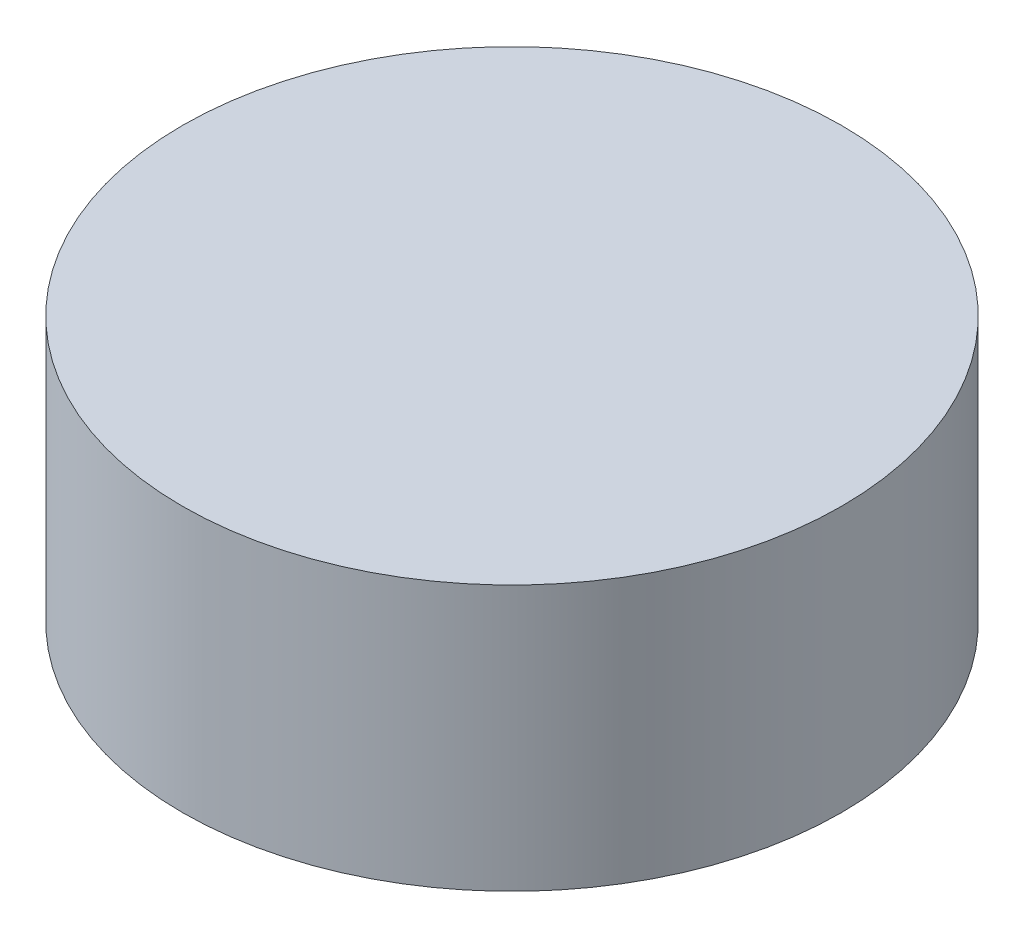
from build123d import *

# Parameters (mm, degrees)
SKETCH1_R           = 43.5
SKETCH1_R_2         = 42
BOSS_EXTRUDE1_DEPTH = 32
SKETCH2_R           = 43.5
BOSS_EXTRUDE2_DEPTH = 3


with BuildPart() as part:
    # Sketch1 → Boss-Extrude1 (new body)
    with BuildSketch(Plane(origin=(0, 0, 0), x_dir=(1, 0, 0), z_dir=(0, 1, 0))):
        with Locations(Location((0, 0, 0), (0, 0, 270))):
            Circle(SKETCH1_R)
        with Locations(Location((0, 0, 0), (0, 0, 270))):
            Circle(SKETCH1_R_2, mode=Mode.SUBTRACT)
    extrude(amount=BOSS_EXTRUDE1_DEPTH)

    # Sketch2 → Boss-Extrude2 (add)
    with BuildSketch(Plane(origin=(0, 32, 0), x_dir=(1, 0, 0), z_dir=(0, 1, 0))):
        with Locations(Location((0, 0, 0), (0, 0, 270))):
            Circle(SKETCH2_R)
    extrude(amount=BOSS_EXTRUDE2_DEPTH)


solid = part.part
